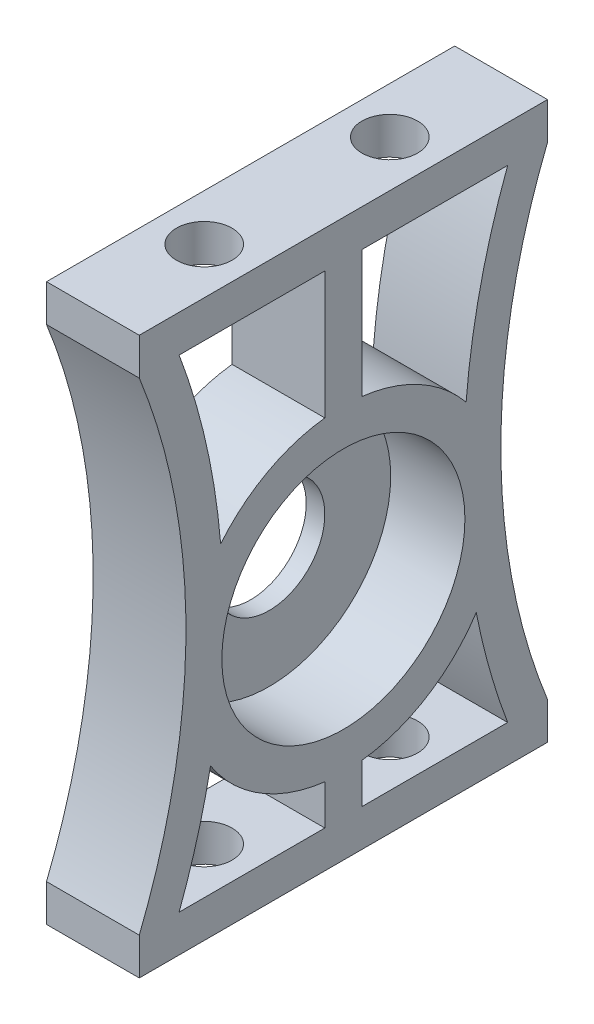
from build123d import *

# Parameters (mm, degrees)
SKETCH1_R           = 6.55
BOSS_EXTRUDE4_DEPTH = 5
SKETCH3_W           = 2
SKETCH3_H           = 8.8
SKETCH3_H_2         = 4.1
BOSS_EXTRUDE5_DEPTH = 5
SKETCH4_R           = 6.55
SKETCH4_R_2         = 3
BOSS_EXTRUDE6_DEPTH = 1
CUT_EXTRUDE1_REACH  = 34.342
SKETCH5_R           = 1.5
CUT_EXTRUDE2_REACH  = 34.342
SKETCH6_R           = 1.5


with BuildPart() as part:
    # Sketch1 → Boss-Extrude4 (new body)
    with BuildSketch(Plane(origin=(0, 0, 0), x_dir=(0, 0, -1), z_dir=(1, 0, 0))):
        with BuildLine():
            ThreePointArc((11, 15.35), (8.486364482, 2.35), (11, -10.65))
            Line((11, -10.65), (11, -12.65))
            Line((11, -12.65), (-11, -12.65))
            Line((-11, -12.65), (-11, -10.65))
            ThreePointArc((-11, -10.65), (-8.486364482, 2.35), (-11, 15.35))
            Line((-11, 15.35), (-11, 17.35))
            Line((-11, 17.35), (11, 17.35))
            Line((11, 17.35), (11, 15.35))
        make_face()
        Circle(SKETCH1_R, mode=Mode.SUBTRACT)
        with BuildLine():
            ThreePointArc((8.853997744, -10.65), (7.881360543, -7.696425461), (7.161040408, -4.671402389))
            ThreePointArc((7.161040408, -4.671402389), (0, -8.55), (-7.161040408, -4.671402389))
            ThreePointArc((-7.161040408, -4.671402389), (-7.881360543, -7.696425461), (-8.853997744, -10.65))
            Line((-8.853997744, -10.65), (8.853997744, -10.65))
        make_face(mode=Mode.SUBTRACT)
        with BuildLine():
            Line((-8.853997744, 15.35), (8.853997744, 15.35))
            ThreePointArc((8.853997744, 15.35), (7.389658447, 10.461671711), (6.614219323, 5.41798881))
            ThreePointArc((6.614219323, 5.41798881), (0, 8.55), (-6.614219323, 5.41798881))
            ThreePointArc((-6.614219323, 5.41798881), (-7.389658447, 10.461671711), (-8.853997744, 15.35))
        make_face(mode=Mode.SUBTRACT)
    extrude(amount=BOSS_EXTRUDE4_DEPTH)

    # Sketch3 → Boss-Extrude5 (add)
    with BuildSketch(Plane(origin=(5, 0, 0), x_dir=(0, 0, -1), z_dir=(1, 0, 0))):
        with Locations((0, 10.95)):
            Rectangle(SKETCH3_W, SKETCH3_H)
        with Locations((0, -8.6)):
            Rectangle(SKETCH3_W, SKETCH3_H_2)
    extrude(amount=-BOSS_EXTRUDE5_DEPTH)

    # Sketch4 → Boss-Extrude6 (add)
    with BuildSketch(Plane.ZY):
        Circle(SKETCH4_R)
        Circle(SKETCH4_R_2, mode=Mode.SUBTRACT)
    extrude(amount=-BOSS_EXTRUDE6_DEPTH)

    # Sketch5 → Cut-Extrude1 (cut, up to next)
    with BuildSketch(Plane.XZ.offset(12.65), mode=Mode.PRIVATE) as cut_extrude1_sk1:
        with Locations(Location((2.5, 5, 0), (0, 0, 270))):
            Circle(SKETCH5_R)
    cut_extrude1_tool1 = extrude(cut_extrude1_sk1.sketch, amount=-CUT_EXTRUDE1_REACH, mode=Mode.PRIVATE) & part.part
    # Sketch5 → Cut-Extrude1 (cut, up to next)
    with BuildSketch(Plane.XZ.offset(12.65), mode=Mode.PRIVATE) as cut_extrude1_sk2:
        with Locations(Location((2.5, -5, 0), (0, 0, 90))):
            Circle(SKETCH5_R)
    cut_extrude1_tool2 = extrude(cut_extrude1_sk2.sketch, amount=-CUT_EXTRUDE1_REACH, mode=Mode.PRIVATE) & part.part
    add(cut_extrude1_tool1.solids().sort_by_distance((2.5, -12.65, 5))[0], mode=Mode.SUBTRACT)
    add(cut_extrude1_tool2.solids().sort_by_distance((2.5, -12.65, -5))[0], mode=Mode.SUBTRACT)

    # Sketch6 → Cut-Extrude2 (cut, up to next)
    with BuildSketch(Plane(origin=(0, 17.35, 0), x_dir=(1, 0, 0), z_dir=(0, 1, 0)), mode=Mode.PRIVATE) as cut_extrude2_sk1:
        with Locations(Location((2.5, -5, 0), (0, 0, 90))):
            Circle(SKETCH6_R)
    cut_extrude2_tool1 = extrude(cut_extrude2_sk1.sketch, amount=-CUT_EXTRUDE2_REACH, mode=Mode.PRIVATE) & part.part
    # Sketch6 → Cut-Extrude2 (cut, up to next)
    with BuildSketch(Plane(origin=(0, 17.35, 0), x_dir=(1, 0, 0), z_dir=(0, 1, 0)), mode=Mode.PRIVATE) as cut_extrude2_sk2:
        with Locations(Location((2.5, 5, 0), (0, 0, 270))):
            Circle(SKETCH6_R)
    cut_extrude2_tool2 = extrude(cut_extrude2_sk2.sketch, amount=-CUT_EXTRUDE2_REACH, mode=Mode.PRIVATE) & part.part
    add(cut_extrude2_tool1.solids().sort_by_distance((2.5, 17.35, 5))[0], mode=Mode.SUBTRACT)
    add(cut_extrude2_tool2.solids().sort_by_distance((2.5, 17.35, -5))[0], mode=Mode.SUBTRACT)


solid = part.part
